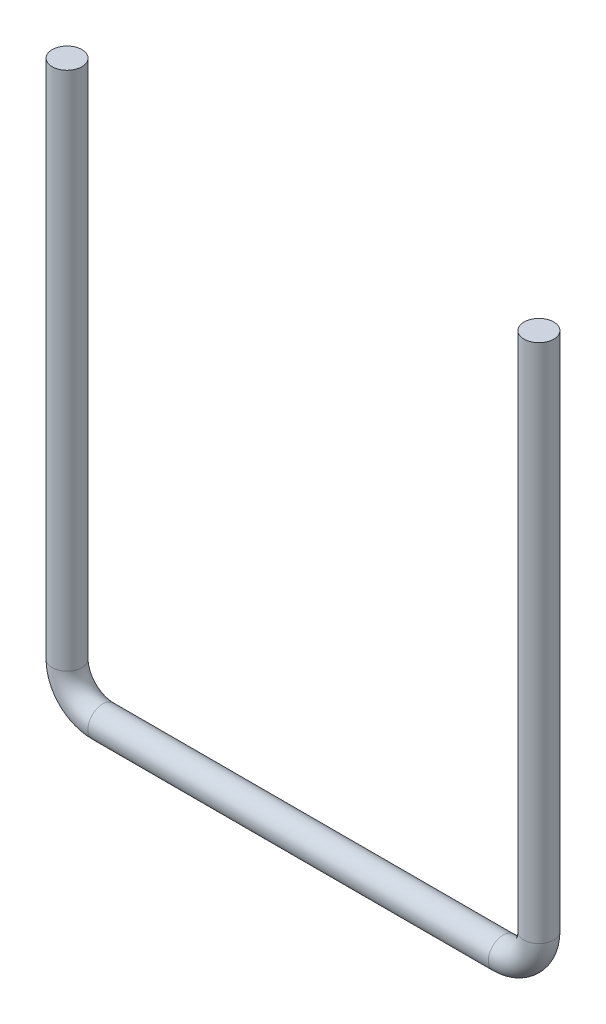
from build123d import *

# Parameters (mm, degrees)
SKETCH7_R = 1.04


with BuildPart() as part:
    # Sweep2: sweep along a path in Sketch6
    with BuildLine(Plane.XY) as sweep2_path:
        Line((0, 0), (0, -36.4))
        ThreePointArc((0, -36.4), (0.732233047, -38.167766953), (2.5, -38.9))
        Line((2.5, -38.9), (30.5, -38.9))
        ThreePointArc((30.5, -38.9), (32.267766953, -38.167766953), (33, -36.4))
        Line((33, -36.4), (33, 0))
    # Sketch7 → Sweep2 (sweep)
    with BuildSketch(Plane(origin=(0, 0, 0), x_dir=(1, 0, 0), z_dir=(0, 1, 0))):
        Circle(SKETCH7_R)
    sweep(path=sweep2_path.line)


solid = part.part
